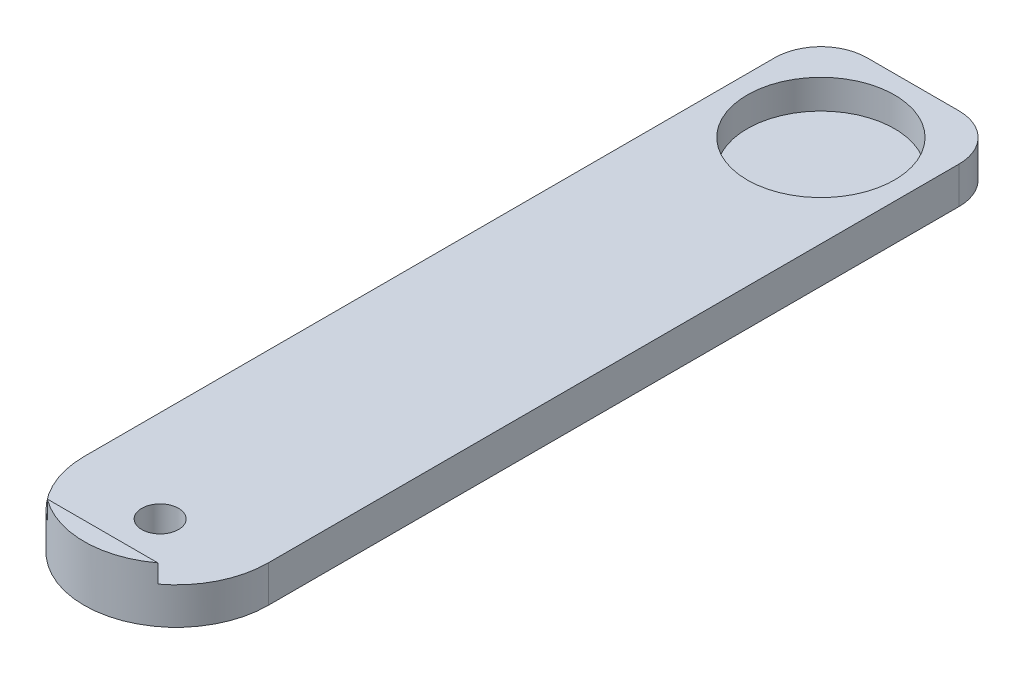
from build123d import *

# Parameters (mm, degrees)
SKETCH1_W           = 20
SKETCH1_H           = 80
BOSS_EXTRUDE1_DEPTH = 4
SKETCH8_R           = 10
BOSS_EXTRUDE2_DEPTH = 4
SKETCH9_R           = 8
CUT_EXTRUDE1_DEPTH  = 3.175
SKETCH10_R          = 2
CUT_EXTRUDE2_DEPTH  = 52.14684741
BOSS_EXTRUDE3_START = 2
BOSS_EXTRUDE3_DEPTH = 2
FILLET1_R           = 5


with BuildPart() as part:
    # Sketch1 → Boss-Extrude1 (new body)
    with BuildSketch(Plane(origin=(0, 0, 0), x_dir=(1, 0, 0), z_dir=(0, 1, 0))):
        Rectangle(SKETCH1_W, SKETCH1_H)
    extrude(amount=BOSS_EXTRUDE1_DEPTH)

    # Sketch8 → Boss-Extrude2 (add)
    with BuildSketch(Plane(origin=(0, 4, 0), x_dir=(1, 0, 0), z_dir=(0, 1, 0))):
        with Locations((0, -40)):
            Circle(SKETCH8_R)
    extrude(amount=-BOSS_EXTRUDE2_DEPTH)

    # Sketch9 → Cut-Extrude1 (cut)
    with BuildSketch(Plane(origin=(0, 4, 0), x_dir=(1, 0, 0), z_dir=(0, 1, 0))):
        with Locations(Location((0, 30, 0), (0, 0, 270))):
            Circle(SKETCH9_R)
    extrude(amount=-CUT_EXTRUDE1_DEPTH, mode=Mode.SUBTRACT)

    # Sketch10 → Cut-Extrude2 (cut, through all)
    with BuildSketch(Plane(origin=(0, 4, 0), x_dir=(1, 0, 0), z_dir=(0, 1, 0))):
        with Locations(Location((0, -41.7425, 0), (0, 0, 270))):
            Circle(SKETCH10_R)
    extrude(amount=-CUT_EXTRUDE2_DEPTH, mode=Mode.SUBTRACT)

    # Sketch11 → Boss-Extrude3 (add)
    with BuildSketch(Plane(origin=(0, 4, 0), x_dir=(1, 0, 0), z_dir=(0, 1, 0)).offset(BOSS_EXTRUDE3_START)):
        with BuildLine():
            Line((-6, -48), (6, -48))
            ThreePointArc((6, -48), (0, -50), (-6, -48))
        make_face()
    extrude(amount=-BOSS_EXTRUDE3_DEPTH)

    # Fillet1
    fillet1_edges = [part.edges().sort_by_distance(p)[0] for p in [
        (-10, 2, -40),
        (10, 2, -40),
    ]]
    fillet(fillet1_edges, radius=FILLET1_R)


solid = part.part
